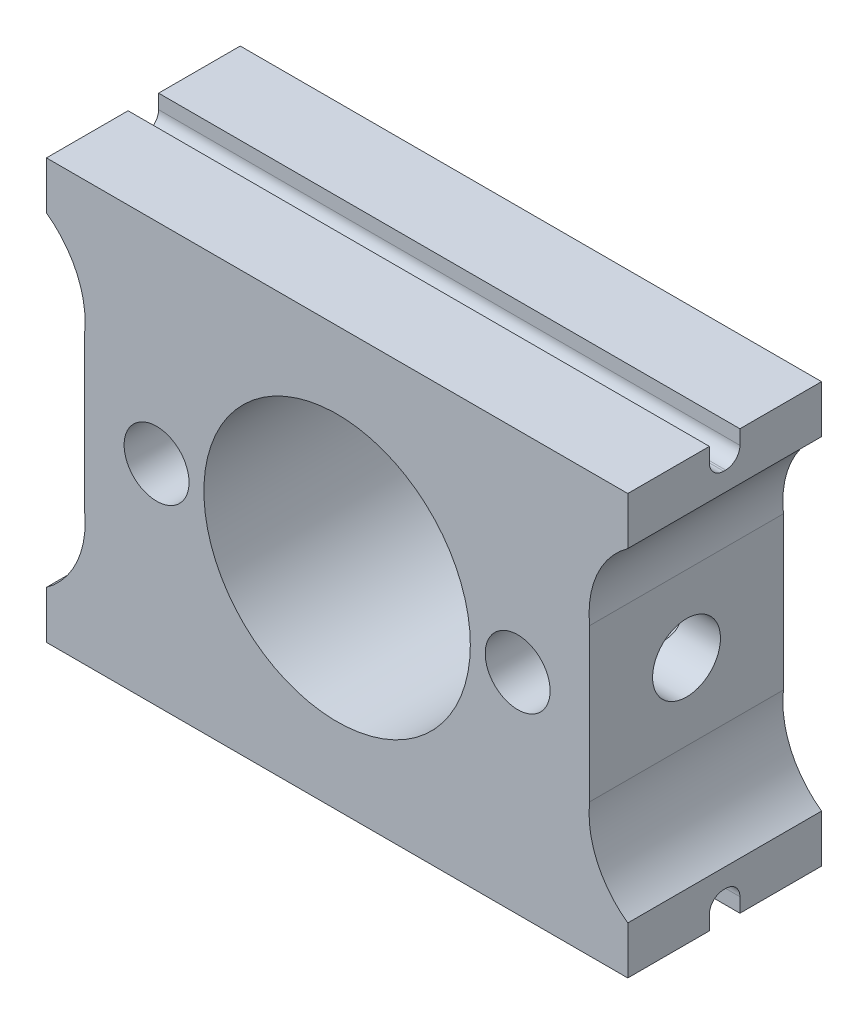
from build123d import *

# Parameters (mm, degrees)
SKETCH1_R           = 0.8509
SKETCH1_R_2         = 3.4925
BOSS_EXTRUDE1_DEPTH = 5.08
SKETCH2_R           = 0.89
CUT_EXTRUDE1_DEPTH  = 2.286
CUT_EXTRUDE2_START  = -2.286
SKETCH3_R           = 0.89
CUT_EXTRUDE2_DEPTH  = 2.286
CUT_EXTRUDE3_DEPTH  = 20.46956602


with BuildPart() as part:
    # Sketch1 → Boss-Extrude1 (new body)
    with BuildSketch(Plane.XY):
        with BuildLine():
            ThreePointArc((0, 9.75), (0.804883509, 8.760503782), (1, 7.5))
            Line((1, 7.5), (1, 3.5))
            ThreePointArc((1, 3.5), (0.804883509, 2.239496218), (0, 1.25))
            Line((0, 1.25), (0, 0))
            Line((0, 0), (15.24, 0))
            Line((15.24, 0), (15.24, 1.25))
            ThreePointArc((15.24, 1.25), (14.435116491, 2.239496218), (14.24, 3.5))
            Line((14.24, 3.5), (14.24, 7.5))
            ThreePointArc((14.24, 7.5), (14.435116491, 8.760503782), (15.24, 9.75))
            Line((15.24, 9.75), (15.24, 11))
            Line((15.24, 11), (0, 11))
            Line((0, 11), (0, 9.75))
        make_face()
        with Locations((2.886809291, 5.5)):
            Circle(SKETCH1_R, mode=Mode.SUBTRACT)
        with Locations((7.62, 5.5)):
            Circle(SKETCH1_R_2, mode=Mode.SUBTRACT)
        with Locations((12.353190709, 5.5)):
            Circle(SKETCH1_R, mode=Mode.SUBTRACT)
    extrude(amount=BOSS_EXTRUDE1_DEPTH)

    # Sketch2 → Cut-Extrude1 (cut)
    with BuildSketch(Plane(origin=(14.24, 0, 0), x_dir=(0, 0, -1), z_dir=(1, 0, 0))):
        with Locations((-2.54, 5.5)):
            Circle(SKETCH2_R)
    extrude(amount=-CUT_EXTRUDE1_DEPTH, mode=Mode.SUBTRACT)

    # Sketch3 → Cut-Extrude2 (cut)
    with BuildSketch(Plane.ZY.offset(-1).offset(CUT_EXTRUDE2_START)):
        with Locations(Location((2.54, 5.5, 0), (0, 0, 180))):
            Circle(SKETCH3_R)
    extrude(amount=CUT_EXTRUDE2_DEPTH, mode=Mode.SUBTRACT)

    # Sketch4 → Cut-Extrude3 (cut, through all)
    with BuildSketch(Plane(origin=(15.24, 0, 0), x_dir=(0, 0, -1), z_dir=(1, 0, 0))):
        with BuildLine():
            Line((-2.94, 0), (-2.14, 0))
            Line((-2.14, 0), (-2.14, 0.376))
            ThreePointArc((-2.14, 0.376), (-2.249542064, 0.640457936), (-2.514, 0.75))
            Line((-2.514, 0.75), (-2.566, 0.75))
            ThreePointArc((-2.566, 0.75), (-2.830457936, 0.640457936), (-2.94, 0.376))
            Line((-2.94, 0.376), (-2.94, 0))
        make_face()
    cut_extrude3 = extrude(amount=-CUT_EXTRUDE3_DEPTH, mode=Mode.SUBTRACT)

    # Mirror1: Cut-Extrude3 across plane
    add(cut_extrude3.mirror(Plane(origin=(0, 5.5, 0), x_dir=(0, 0, 1), z_dir=(0, -1, 0))), mode=Mode.SUBTRACT)


solid = part.part
